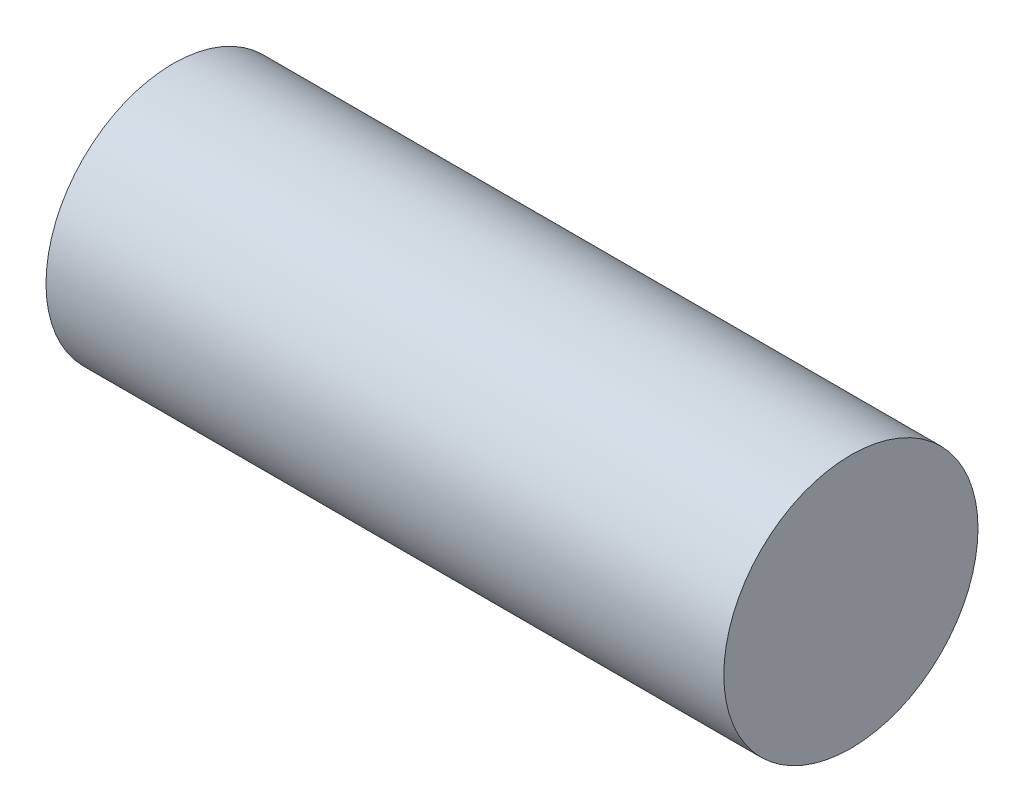
from build123d import *

# Parameters (mm, degrees)
SKETCH1_R           = 9.525
BOSS_EXTRUDE1_DEPTH = 50.8


with BuildPart() as part:
    # Sketch1 → Boss-Extrude1 (new body)
    with BuildSketch(Plane(origin=(0, 0, 0), x_dir=(0, 0, -1), z_dir=(1, 0, 0))):
        Circle(SKETCH1_R)
    extrude(amount=BOSS_EXTRUDE1_DEPTH)


solid = part.part
